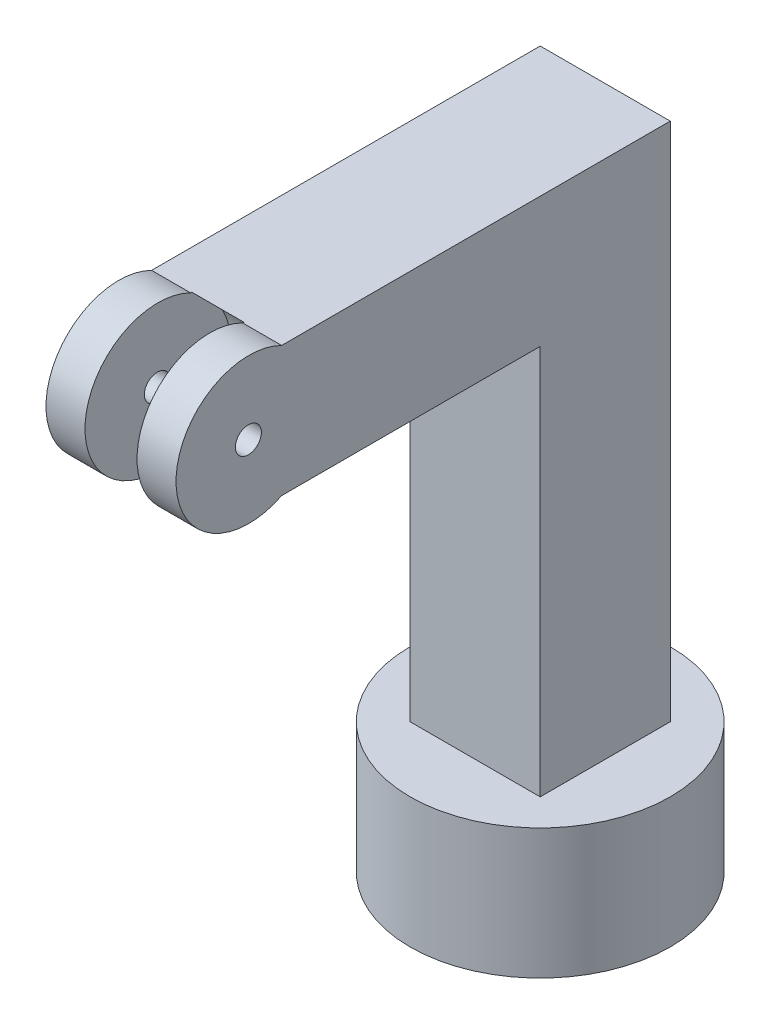
from build123d import *

# Parameters (mm, degrees)
SKETCH1_R               = 25
BOSS_EXTRUDE1_DEPTH     = 25
SKETCH2_W               = 25
SKETCH2_H               = 25
BOSS_EXTRUDE2_DEPTH     = 100
SKETCH7_R               = 5
CUT_EXTRUDE2_DEPTH      = 10
SKETCH8_W               = 25
SKETCH8_H               = 25
BOSS_EXTRUDE3_DEPTH     = 50
SKETCH10_R              = 14
BOSS_EXTRUDE4_DEPTH     = 12.5
SKETCH13_R              = 14.15
CUT_EXTRUDE4_DEPTH      = 5
CUT_EXTRUDE5_DEPTH      = 154.080044421
CUT_EXTRUDE5_DEPTH_BACK = 154.080044421
SKETCH14_R              = 2.5


with BuildPart() as part:
    # Sketch1 → Boss-Extrude1 (new body)
    with BuildSketch(Plane(origin=(0, 0, 0), x_dir=(1, 0, 0), z_dir=(0, 1, 0))):
        Circle(SKETCH1_R)
    extrude(amount=BOSS_EXTRUDE1_DEPTH)

    # Sketch2 → Boss-Extrude2 (add)
    with BuildSketch(Plane(origin=(0, 25, 0), x_dir=(1, 0, 0), z_dir=(0, 1, 0))):
        Rectangle(SKETCH2_W, SKETCH2_H)
    extrude(amount=BOSS_EXTRUDE2_DEPTH)

    # Sketch7 → Cut-Extrude2 (cut)
    with BuildSketch(Plane.XZ):
        Circle(SKETCH7_R)
    extrude(amount=-CUT_EXTRUDE2_DEPTH, mode=Mode.SUBTRACT)

    # Sketch8 → Boss-Extrude3 (add)
    with BuildSketch(Plane.XY.offset(12.5)):
        with Locations((0, 112.5)):
            Rectangle(SKETCH8_W, SKETCH8_H)
    extrude(amount=BOSS_EXTRUDE3_DEPTH)

    # Sketch10 → Boss-Extrude4 (add, symmetric)
    with BuildSketch(Plane(origin=(0, 0, 0), x_dir=(0, 0, -1), z_dir=(1, 0, 0))):
        with Locations((-68.5, 112.5)):
            Circle(SKETCH10_R)
    extrude(amount=BOSS_EXTRUDE4_DEPTH, both=True)

    # Sketch13 → Cut-Extrude4 (cut, symmetric)
    with BuildSketch(Plane(origin=(0, 0, 0), x_dir=(0, 0, -1), z_dir=(1, 0, 0))):
        with Locations((-68.595239894, 112.5)):
            Circle(SKETCH13_R)
    extrude(amount=CUT_EXTRUDE4_DEPTH, both=True, mode=Mode.SUBTRACT)

    # Sketch14 → Cut-Extrude5 (cut, two sides: drawn at the far end of the back side and taken through both)
    with BuildSketch(Plane(origin=(0, 0, 0), x_dir=(0, 0, -1), z_dir=(1, 0, 0)).offset(-CUT_EXTRUDE5_DEPTH_BACK)):
        with Locations((-68.595239894, 112.5)):
            Circle(SKETCH14_R)
    extrude(amount=CUT_EXTRUDE5_DEPTH + CUT_EXTRUDE5_DEPTH_BACK, mode=Mode.SUBTRACT)


solid = part.part
